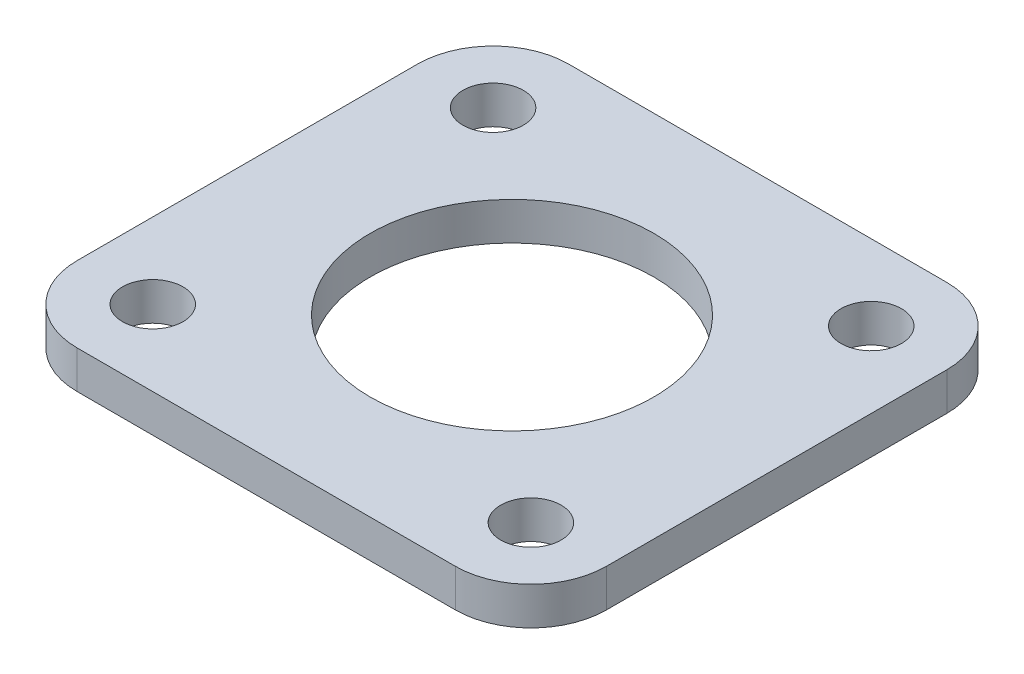
from build123d import *

# Parameters (mm, degrees)
SKETCH_1_W          = 28
SKETCH_1_H          = 26
SKETCH_1_R          = 1.6
EXTRUDE_1_DEPTH     = 2
SKETCH_2_R          = 7.5
CUT_EXTRUDE_1_DEPTH = 2
FILLET_1_R          = 4


with BuildPart() as part:
    # 草图1 → 凸台-拉伸1 (new body)
    with BuildSketch(Plane(origin=(0, 0, 0), x_dir=(1, 0, 0), z_dir=(0, 1, 0))):
        Rectangle(SKETCH_1_W, SKETCH_1_H)
        with Locations(Location((10, -9, 0), (0, 0, 270))):
            Circle(SKETCH_1_R, mode=Mode.SUBTRACT)
        with Locations(Location((-10, -9, 0), (0, 0, 270))):
            Circle(SKETCH_1_R, mode=Mode.SUBTRACT)
        with Locations(Location((-10, 9, 0), (0, 0, 270))):
            Circle(SKETCH_1_R, mode=Mode.SUBTRACT)
        with Locations(Location((10, 9, 0), (0, 0, 270))):
            Circle(SKETCH_1_R, mode=Mode.SUBTRACT)
    extrude(amount=EXTRUDE_1_DEPTH)

    # 草图2 → 切除-拉伸1 (cut)
    with BuildSketch(Plane(origin=(0, 2, 0), x_dir=(1, 0, 0), z_dir=(0, 1, 0))):
        with Locations(Location((0, 0, 0), (0, 0, 270))):
            Circle(SKETCH_2_R)
    extrude(amount=-CUT_EXTRUDE_1_DEPTH, mode=Mode.SUBTRACT)

    # 圆角1
    fillet_1_edges = [part.edges().sort_by_distance(p)[0] for p in [
        (14, 1, 13),
        (-14, 1, 13),
        (-14, 1, -13),
        (14, 1, -13),
    ]]
    fillet(fillet_1_edges, radius=FILLET_1_R)


solid = part.part
